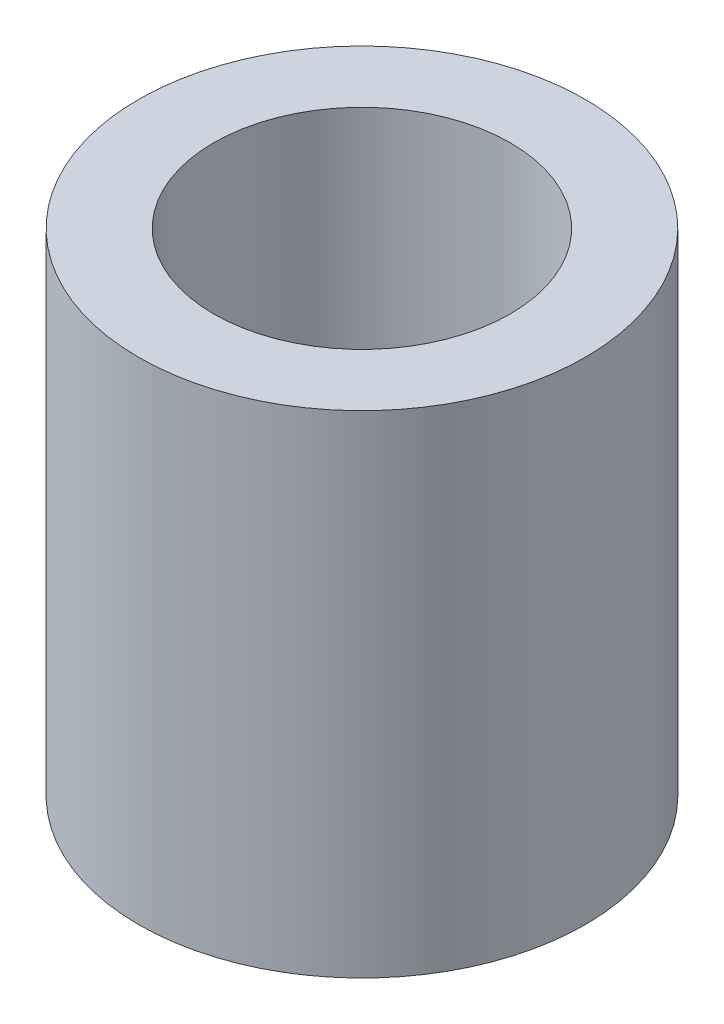
from build123d import *

# Parameters (mm, degrees)
SKETCH1_R                   = 6.35
BOSS_EXTRUDE1_DEPTH         = 13.97
TAP_DRILL_FOR_3_8_24_TAP1_D = 8.4328


with BuildPart() as part:
    # Sketch1 → Boss-Extrude1 (new body)
    with BuildSketch(Plane(origin=(0, 0, 0), x_dir=(1, 0, 0), z_dir=(0, 1, 0))):
        with Locations(Location((0, 0, 0), (0, 0, 270))):
            Circle(SKETCH1_R)
    extrude(amount=BOSS_EXTRUDE1_DEPTH)

    # Tap Drill for 3/8-24 Tap1 (through all)
    with Locations(Plane(origin=(0, 13.97, 0), x_dir=(1, 0, 0), z_dir=(0, 1, 0))):
        with Locations((0, 0)):
            Hole(TAP_DRILL_FOR_3_8_24_TAP1_D / 2)


solid = part.part
